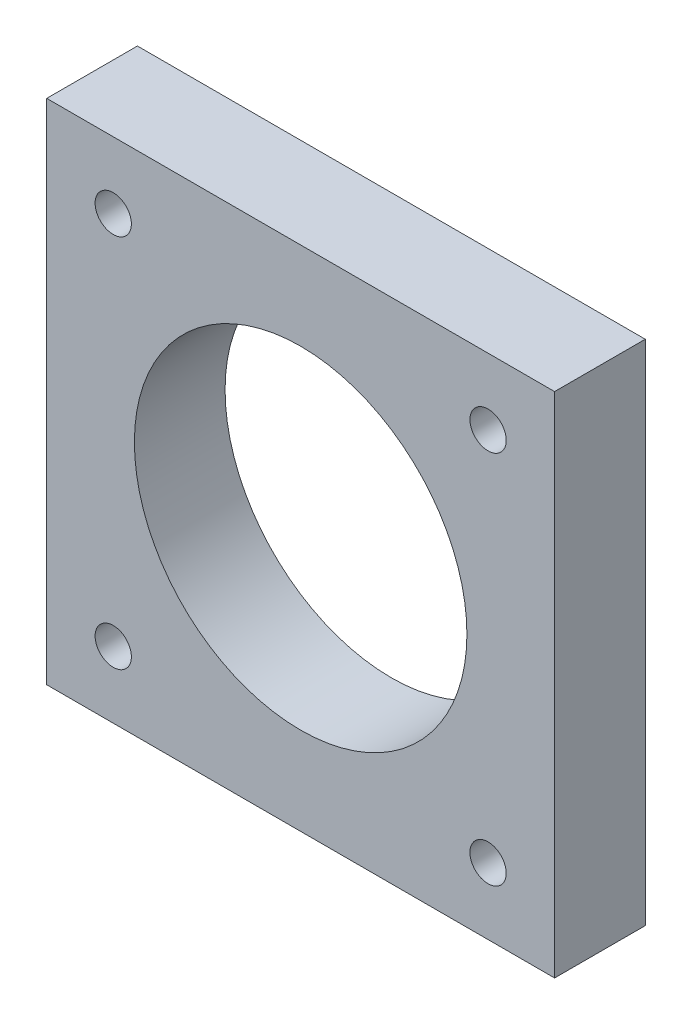
from build123d import *

# Parameters (mm, degrees)
SKETCH1_W           = 42
SKETCH1_H           = 42
SKETCH1_R           = 1.5
SKETCH1_R_2         = 13.75
BOSS_EXTRUDE1_DEPTH = 7.5


with BuildPart() as part:
    # Sketch1 → Boss-Extrude1 (new body)
    with BuildSketch(Plane.XY):
        with Locations((21, 21)):
            Rectangle(SKETCH1_W, SKETCH1_H)
        with Locations((5.5, 5.5)):
            Circle(SKETCH1_R, mode=Mode.SUBTRACT)
        with Locations((36.5, 5.5)):
            Circle(SKETCH1_R, mode=Mode.SUBTRACT)
        with Locations((36.5, 36.5)):
            Circle(SKETCH1_R, mode=Mode.SUBTRACT)
        with Locations((5.5, 36.5)):
            Circle(SKETCH1_R, mode=Mode.SUBTRACT)
        with Locations((21, 21)):
            Circle(SKETCH1_R_2, mode=Mode.SUBTRACT)
    extrude(amount=BOSS_EXTRUDE1_DEPTH)


solid = part.part
